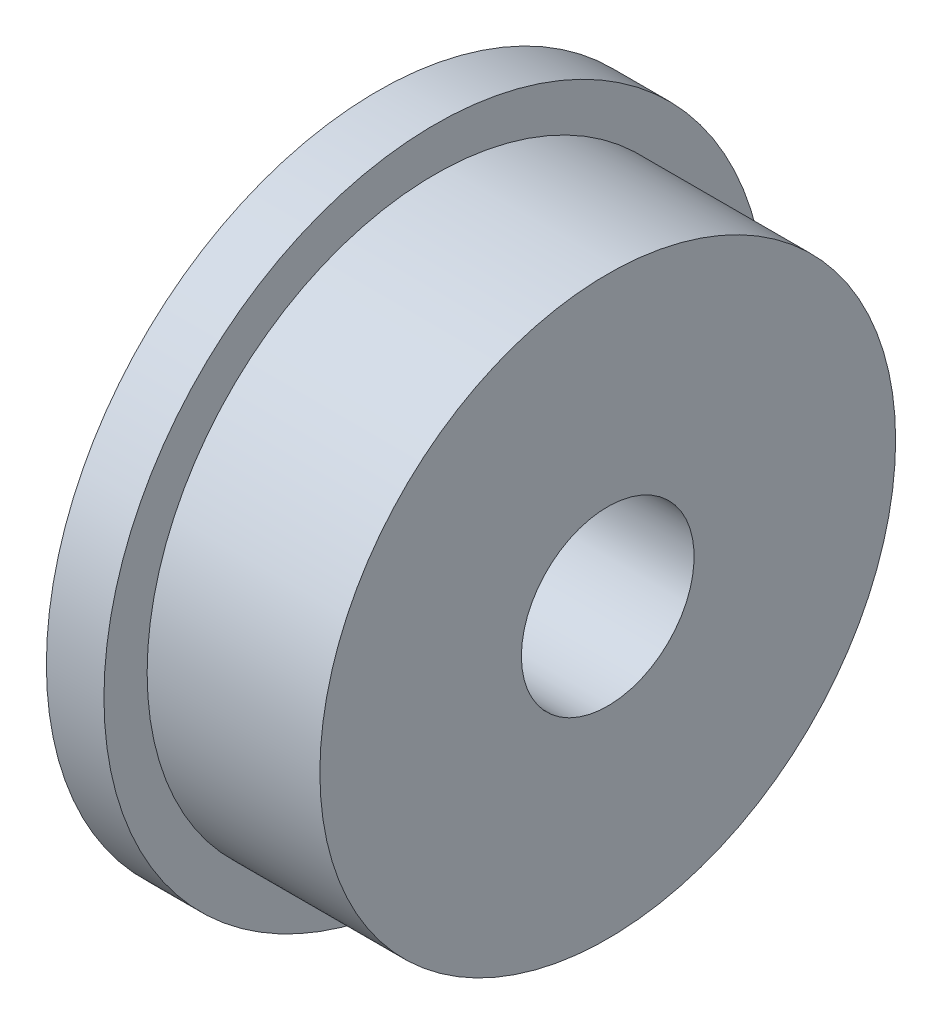
from build123d import *


with BuildPart() as part:
    # Sketch1 → Revolve1 (revolve)
    with BuildSketch(Plane.XY, mode=Mode.PRIVATE) as revolve1_sk:
        Polygon((3.987317977, 1.5), (3.987317977, 5.75), (4.987317977, 5.75), (4.987317977, 5), (7.987317977, 5), (7.987317977, 1.5), align=None)
    revolve(revolve1_sk.sketch.rotate(Axis((0, 0, 0), (1, 0, 0)), 90), axis=Axis((0, 0, 0), (1, 0, 0)))


solid = part.part
